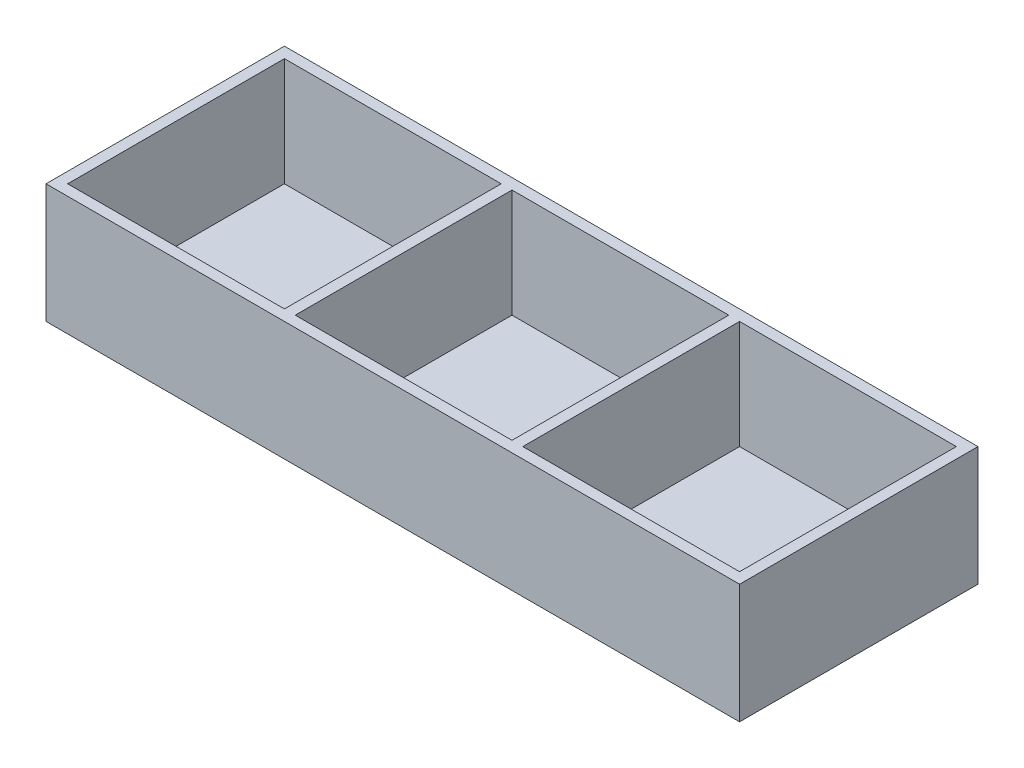
from build123d import *

# Parameters (mm, degrees)
SKETCH_1_W       = 320
SKETCH_1_H       = 110
EXTRUDE_1_DEPTH  = 55
SHELL_1_T        = -5
RIB_1_REACH      = 179.904
SKETCH_2_WALLS_W = 5
SKETCH_2_WALLS_H = 457.808937494


with BuildPart() as part:
    # 草图1 → 凸台-拉伸1 (new body)
    with BuildSketch(Plane(origin=(0, 0, 0), x_dir=(1, 0, 0), z_dir=(0, 1, 0))):
        Rectangle(SKETCH_1_W, SKETCH_1_H)
    extrude(amount=EXTRUDE_1_DEPTH)

    # 抽壳1
    shell_1_openings = [part.faces().sort_by_distance(p)[0] for p in [
        (0, 55, 0),
    ]]
    offset(amount=SHELL_1_T, openings=shell_1_openings, kind=Kind.INTERSECTION)

    # 草图2 walls → 筋1 (add, up to next)
    with BuildSketch(Plane(origin=(0, 55, 0), x_dir=(1, 0, 0), z_dir=(0, 1, 0)), mode=Mode.PRIVATE) as rib_1_sk1:
        with Locations((52.5, 0)):
            Rectangle(SKETCH_2_WALLS_W, SKETCH_2_WALLS_H)
    rib_1_tool1 = extrude(rib_1_sk1.sketch, amount=-RIB_1_REACH, mode=Mode.PRIVATE) - part.part
    # 草图2 walls → 筋1 (add, up to next)
    with BuildSketch(Plane(origin=(0, 55, 0), x_dir=(1, 0, 0), z_dir=(0, 1, 0)), mode=Mode.PRIVATE) as rib_1_sk2:
        with Locations((-52.5, 0)):
            Rectangle(SKETCH_2_WALLS_W, SKETCH_2_WALLS_H)
    rib_1_tool2 = extrude(rib_1_sk2.sketch, amount=-RIB_1_REACH, mode=Mode.PRIVATE) - part.part
    add(rib_1_tool1.solids().sort_by_distance((52.5, 55, 0))[0])
    add(rib_1_tool2.solids().sort_by_distance((-52.5, 55, 0))[0])


solid = part.part
